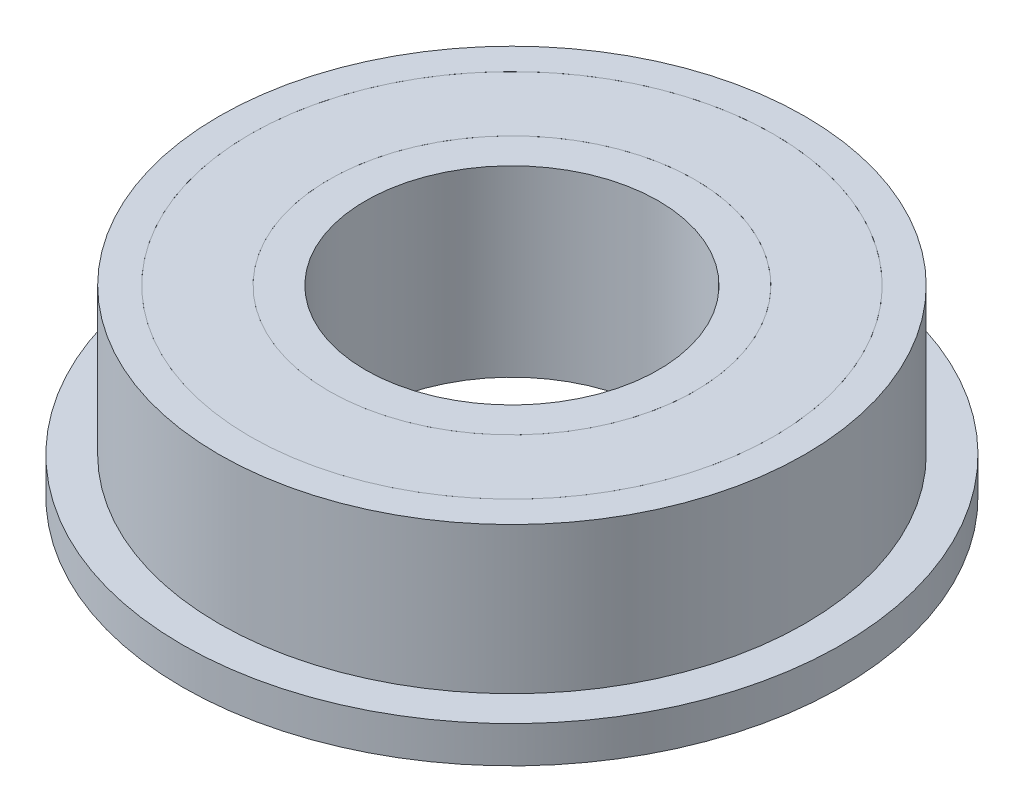
from build123d import *

# Parameters (mm, degrees)
SKETCH1_R           = 9
BOSS_EXTRUDE1_DEPTH = 1
SKETCH2_R           = 8
BOSS_EXTRUDE2_DEPTH = 4
SKETCH3_R           = 7.15
CUT_EXTRUDE1_DEPTH  = 14
SKETCH4_R           = 7.15
BOSS_EXTRUDE3_DEPTH = 5
SKETCH5_R           = 5
CUT_EXTRUDE2_DEPTH  = 14
SKETCH6_R           = 5
BOSS_EXTRUDE4_DEPTH = 5
SKETCH7_R           = 4
CUT_EXTRUDE3_DEPTH  = 14


with BuildPart() as part:
    # Sketch1 → Boss-Extrude1 (new body)
    with BuildSketch(Plane(origin=(0, 0, 0), x_dir=(1, 0, 0), z_dir=(0, 1, 0))):
        with Locations(Location((0, 0, 0), (0, 0, 270))):
            Circle(SKETCH1_R)
    extrude(amount=BOSS_EXTRUDE1_DEPTH)

    # Sketch2 → Boss-Extrude2 (add)
    with BuildSketch(Plane(origin=(0, 1, 0), x_dir=(1, 0, 0), z_dir=(0, 1, 0))):
        with Locations(Location((0, 0, 0), (0, 0, 270))):
            Circle(SKETCH2_R)
    extrude(amount=BOSS_EXTRUDE2_DEPTH)

    # Sketch3 → Cut-Extrude1 (cut)
    with BuildSketch(Plane(origin=(0, 5, 0), x_dir=(1, 0, 0), z_dir=(0, 1, 0))):
        with Locations(Location((0, 0, 0), (0, 0, 270))):
            Circle(SKETCH3_R)
    extrude(amount=-CUT_EXTRUDE1_DEPTH, mode=Mode.SUBTRACT)


with BuildPart() as body_2:
    # Sketch4 → Boss-Extrude3 (new body)
    with BuildSketch(Plane.XZ):
        with Locations(Location((0, 0, 0), (0, 0, 270))):
            Circle(SKETCH4_R)
    extrude(amount=-BOSS_EXTRUDE3_DEPTH)

    # Sketch5 → Cut-Extrude2 (cut)
    with BuildSketch(Plane(origin=(0, 5, 0), x_dir=(1, 0, 0), z_dir=(0, 1, 0))):
        with Locations(Location((0, 0, 0), (0, 0, 270))):
            Circle(SKETCH5_R)
    extrude(amount=-CUT_EXTRUDE2_DEPTH, mode=Mode.SUBTRACT)


with BuildPart() as body_3:
    # Sketch6 → Boss-Extrude4 (new body)
    with BuildSketch(Plane.XZ):
        with Locations(Location((0, 0, 0), (0, 0, 270))):
            Circle(SKETCH6_R)
    extrude(amount=-BOSS_EXTRUDE4_DEPTH)

    # Sketch7 → Cut-Extrude3 (cut)
    with BuildSketch(Plane(origin=(0, 5, 0), x_dir=(1, 0, 0), z_dir=(0, 1, 0))):
        with Locations(Location((0, 0, 0), (0, 0, 270))):
            Circle(SKETCH7_R)
    extrude(amount=-CUT_EXTRUDE3_DEPTH, mode=Mode.SUBTRACT)


solid = Compound([part.part, body_2.part, body_3.part])
